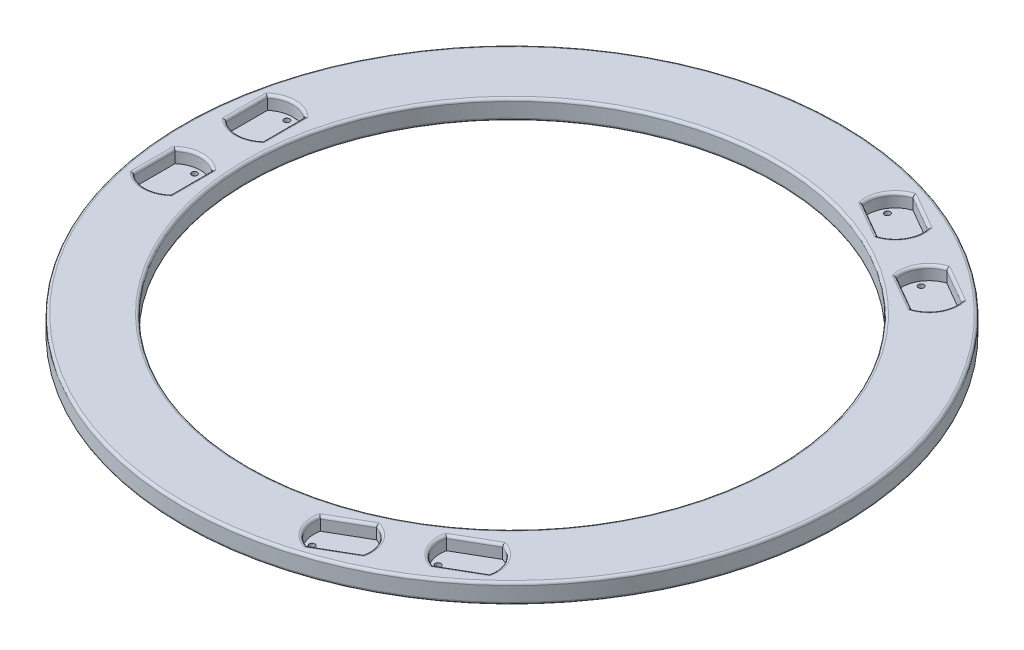
from build123d import *

# Parameters (mm, degrees)
SKETCH1_R            = 250
SKETCH1_R_2          = 200
BOSS_EXTRUDE1_DEPTH  = 15
CUT_EXTRUDE1_DEPTH   = 10
FILLET1_R            = 2
M4_CLEARANCE_HOLE1_D = 4.3


with BuildPart() as part:
    # Sketch1 → Boss-Extrude1 (new body)
    with BuildSketch(Plane(origin=(0, 0, 0), x_dir=(1, 0, 0), z_dir=(0, 1, 0))):
        with Locations(Location((0, 0, 0), (0, 0, 270))):
            Circle(SKETCH1_R)
        with Locations(Location((0, 0, 0), (0, 0, 270))):
            Circle(SKETCH1_R_2, mode=Mode.SUBTRACT)
    extrude(amount=BOSS_EXTRUDE1_DEPTH)

    # Sketch2 → Cut-Extrude1 (cut)
    with BuildSketch(Plane(origin=(0, 15, 0), x_dir=(1, 0, 0), z_dir=(0, 1, 0))):
        with BuildLine():
            Line((74.267750945, 229.935518), (101.374346083, 214.285518))
            ThreePointArc((101.374346083, 214.285518), (99.008054469, 199.486981355), (87.378633605, 190.034331292))
            Line((87.378633605, 190.034331292), (60.263463422, 205.689282096))
            ThreePointArc((60.263463422, 205.689282096), (62.634988078, 220.486981027), (74.267750945, 229.935518))
        make_face()
        with BuildLine():
            Line((134.889529209, 194.935518), (161.996124348, 179.285518))
            ThreePointArc((161.996124348, 179.285518), (159.629832734, 164.486981355), (148.00041187, 155.034331292))
            Line((148.00041187, 155.034331292), (120.885241687, 170.689282096))
            ThreePointArc((120.885241687, 170.689282096), (123.256766343, 185.486981027), (134.889529209, 194.935518))
        make_face()
        with BuildLine():
            Line((161.996124348, -179.285518), (134.88952921, -194.935518))
            ThreePointArc((134.88952921, -194.935518), (123.256766343, -185.486981027), (120.885241687, -170.689282096))
            Line((120.885241687, -170.689282096), (148.00041187, -155.034331292))
            ThreePointArc((148.00041187, -155.034331292), (159.629832734, -164.486981355), (161.996124348, -179.285518))
        make_face()
        with BuildLine():
            Line((87.378633605, -190.034331292), (60.263463422, -205.689282096))
            ThreePointArc((60.263463422, -205.689282096), (62.634988078, -220.486981027), (74.267750945, -229.935518))
            Line((74.267750945, -229.935518), (101.374346083, -214.285518))
            ThreePointArc((101.374346083, -214.285518), (99.008054469, -199.486981355), (87.378633605, -190.034331292))
        make_face()
        with BuildLine():
            Line((-236.263875293, -50.65), (-236.263875293, -19.35))
            ThreePointArc((-236.263875293, -19.35), (-222.264820812, -14.000000328), (-208.263875293, -19.345049196))
            Line((-208.263875293, -19.345049196), (-208.263875293, -50.654950804))
            ThreePointArc((-208.263875293, -50.654950804), (-222.264820812, -55.999999672), (-236.263875293, -50.65))
        make_face()
        with BuildLine():
            Line((-208.263875293, 19.345049196), (-208.263875293, 50.654950804))
            ThreePointArc((-208.263875293, 50.654950804), (-222.264820812, 55.999999672), (-236.263875293, 50.65))
            Line((-236.263875293, 50.65), (-236.263875293, 19.35))
            ThreePointArc((-236.263875293, 19.35), (-222.264820812, 14.000000328), (-208.263875293, 19.345049196))
        make_face()
    extrude(amount=-CUT_EXTRUDE1_DEPTH, mode=Mode.SUBTRACT)

    # Fillet1
    fillet1_edges = [part.edges().sort_by_distance(p)[0] for p in [
        (62.634988078, 15, -220.486981027),
        (73.821048514, 15, -197.861806694),
        (99.008054469, 15, -199.486981355),
        (87.821048514, 15, -222.110518),
        (0, 0, -250),
        (123.256766343, 15, -185.486981027),
        (134.442826779, 15, -162.861806694),
        (159.629832734, 15, -164.486981355),
        (148.442826779, 15, -187.110518),
        (159.629832734, 15, 164.486981355),
        (134.442826779, 15, 162.861806694),
        (123.256766343, 15, 185.486981027),
        (148.442826779, 15, 187.110518),
        (0, 15, -250),
        (99.008054469, 15, 199.486981355),
        (73.821048514, 15, 197.861806694),
        (62.634988078, 15, 220.486981027),
        (87.821048514, 15, 222.110518),
        (0, 0, -200),
        (0, 15, -200),
        (-222.264820812, 15, 55.999999672),
        (-208.263875293, 15, 35),
        (-222.264820812, 15, 14.000000328),
        (-236.263875293, 15, 35),
        (-222.264820812, 15, -14.000000328),
        (-208.263875293, 15, -35),
        (-222.264820812, 15, -55.999999672),
        (-236.263875293, 15, -35),
    ]]
    fillet(fillet1_edges, radius=FILLET1_R)

    # M4 Clearance Hole1 (through all)
    with Locations(Plane(origin=(0, 5, 0), x_dir=(1, 0, 0), z_dir=(0, 1, 0))):
        with Locations((-222.264820812, -18.5), (-222.264820812, -51.5), (-222.264820812, 51.5), (-222.264820812, 18.5), (66.532102111, 218.236981191), (95.110940436, 201.736981191), (127.153880376, 183.236981191), (155.732718701, 166.736981191), (155.732718701, -166.736981191), (127.153880376, -183.236981191), (95.110940435, -201.736981191), (66.53210211, -218.236981191)):
            Hole(M4_CLEARANCE_HOLE1_D / 2)


solid = part.part
